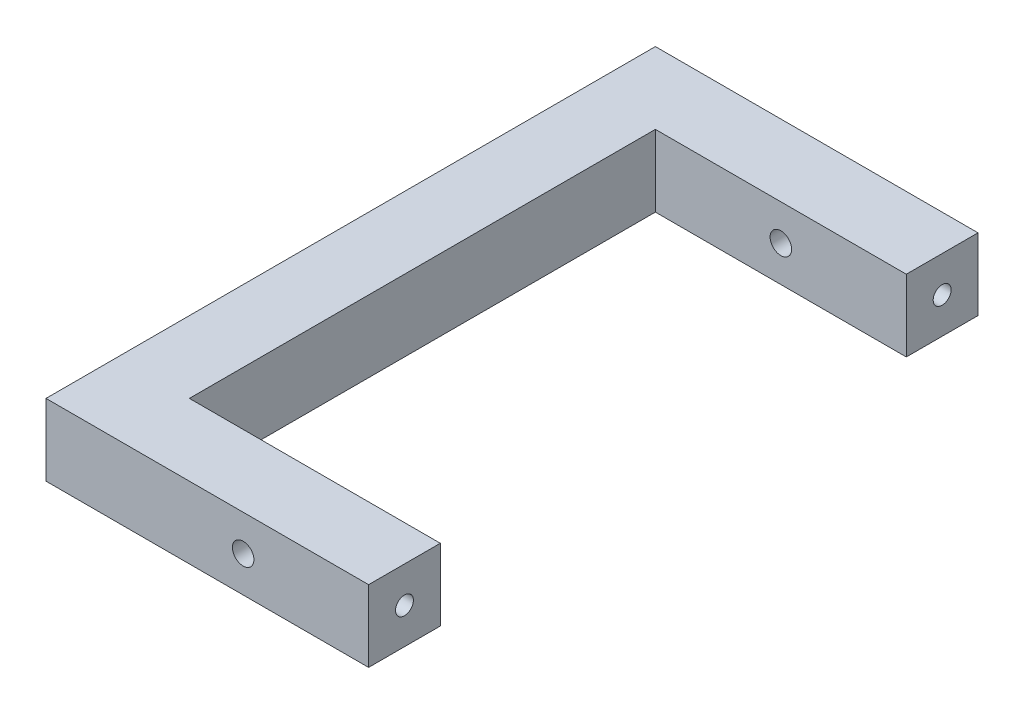
from build123d import *

# Parameters (mm, degrees)
BOSS_EXTRUDE1_DEPTH = 40
SKETCH2_R           = 6
CUT_EXTRUDE1_DEPTH  = 395
SKETCH3_R           = 5
CUT_EXTRUDE2_DEPTH  = 50


with BuildPart() as part:
    # Sketch1 → Boss-Extrude1 (new body)
    with BuildSketch(Plane(origin=(0, 0, 0), x_dir=(1, 0, 0), z_dir=(0, 1, 0))):
        Polygon((0, 170), (180, 170), (180, 130), (40, 130), (40, -130), (180, -130), (180, -170), (0, -170), align=None)
    extrude(amount=BOSS_EXTRUDE1_DEPTH)

    # Sketch2 → Cut-Extrude1 (cut)
    with BuildSketch(Plane.XY.offset(170)):
        with Locations((110, 20)):
            Circle(SKETCH2_R)
    extrude(amount=-CUT_EXTRUDE1_DEPTH, mode=Mode.SUBTRACT)

    # Sketch3 → Cut-Extrude2 (cut)
    with BuildSketch(Plane(origin=(180, 0, 0), x_dir=(0, 0, -1), z_dir=(1, 0, 0))):
        with Locations((-150, 20)):
            Circle(SKETCH3_R)
        with Locations(Location((150, 20, 0), (0, 0, 180))):
            Circle(SKETCH3_R)
    extrude(amount=-CUT_EXTRUDE2_DEPTH, mode=Mode.SUBTRACT)


solid = part.part
